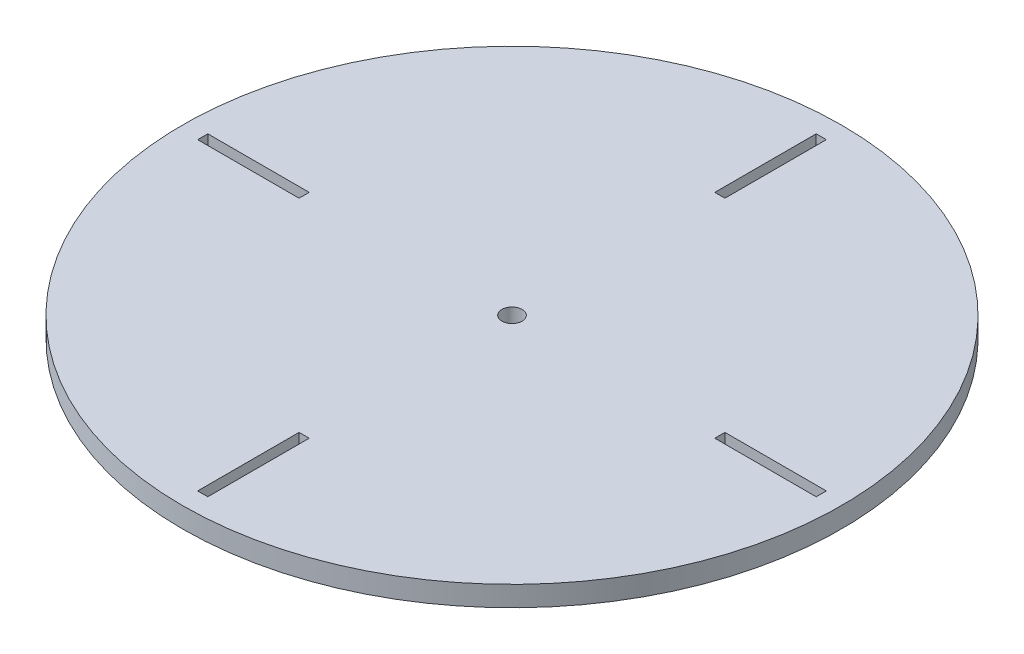
from build123d import *

# Parameters (mm, degrees)
SKETCH1_R           = 82.55
SKETCH1_R_2         = 2.54
SKETCH1_W           = 25.4
SKETCH1_H           = 2.54
SKETCH1_W_2         = 2.54
SKETCH1_H_2         = 25.4
BOSS_EXTRUDE1_DEPTH = 5.08


with BuildPart() as part:
    # Sketch1 → Boss-Extrude1 (new body)
    with BuildSketch(Plane(origin=(0, 0, 0), x_dir=(1, 0, 0), z_dir=(0, 1, 0))):
        with Locations(Location((0, 0, 0), (0, 0, 270))):
            Circle(SKETCH1_R)
        with Locations(Location((0, 0, 0), (0, 0, 270))):
            Circle(SKETCH1_R_2, mode=Mode.SUBTRACT)
        with Locations((64.77, 0)):
            Rectangle(SKETCH1_W, SKETCH1_H, mode=Mode.SUBTRACT)
        with Locations((0, 64.77)):
            Rectangle(SKETCH1_W_2, SKETCH1_H_2, mode=Mode.SUBTRACT)
        with Locations((0, -64.77)):
            Rectangle(SKETCH1_W_2, SKETCH1_H_2, mode=Mode.SUBTRACT)
        with Locations((-64.77, 0)):
            Rectangle(SKETCH1_W, SKETCH1_H, mode=Mode.SUBTRACT)
    extrude(amount=BOSS_EXTRUDE1_DEPTH)


solid = part.part
